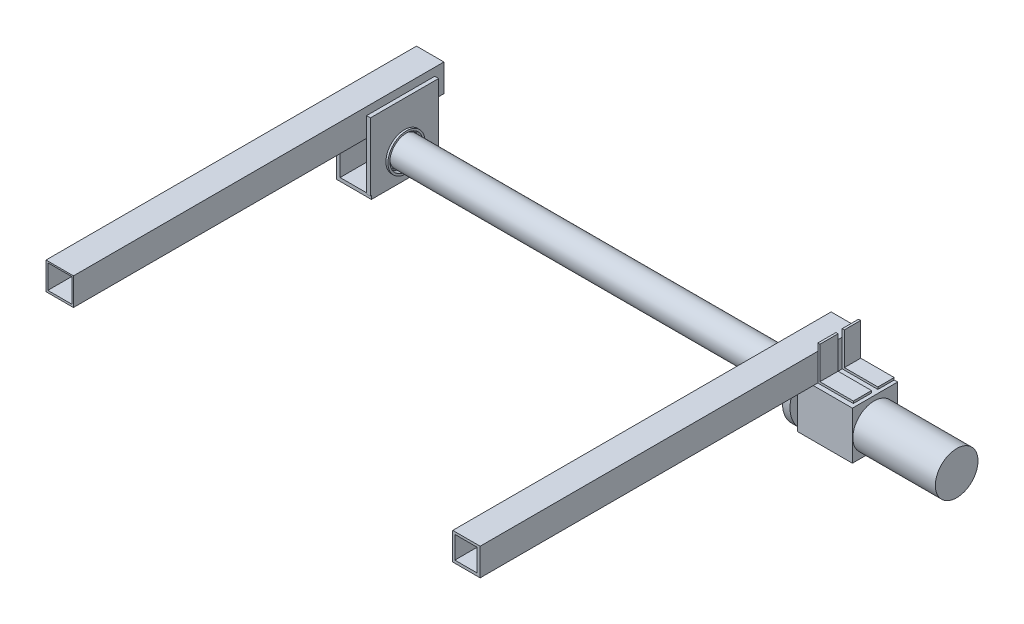
from build123d import *

# Parameters (mm, degrees)
SKETCH_1_W          = 25.57
SKETCH_1_H          = 25.57
EXTRUDE_1_DEPTH     = 345
SKETCH_2_W          = 22.27
SKETCH_2_H          = 22.27
CUT_EXTRUDE_1_DEPTH = 345
SKETCH_3_W          = 62.57
SKETCH_3_H          = 64.82
EXTRUDE_2_DEPTH     = 3.58
SKETCH_4_W          = 63.54
SKETCH_4_H          = 63.15
EXTRUDE_3_DEPTH     = 3.58
SKETCH_6_W          = 32.73
SKETCH_6_H          = 62.57
EXTRUDE_4_DEPTH     = 3.15
SKETCH_7_R          = 14.595
CUT_EXTRUDE_3_DEPTH = 3.32
SKETCH_8_R          = 17.266528804
EXTRUDE_5_DEPTH     = 1.86
SKETCH_9_R          = 15.5
CUT_EXTRUDE_5_DEPTH = 5
SKETCH_10_R         = 13.593774784
EXTRUDE_6_DEPTH     = 380
SKETCH_11_R         = 12.339130987
EXTRUDE_7_DEPTH     = 18
SKETCH_12_R         = 16.175538184
EXTRUDE_8_DEPTH     = 1.5
SKETCH_13_R         = 28
EXTRUDE_9_DEPTH     = 7
SKETCH_14_R         = 7.6
EXTRUDE_10_DEPTH    = 15.2
SKETCH_15_W         = 42.168470392
SKETCH_15_H         = 44.467815759
EXTRUDE_11_DEPTH    = 51.24
SKETCH_16_R         = 19.865
EXTRUDE_12_DEPTH    = 76.83
SKETCH_17_W         = 25.55
SKETCH_17_H         = 352.4
EXTRUDE_14_DEPTH    = 25.55
SKETCH_19_W         = 20.781659092
SKETCH_19_H         = 20.781659093
CUT_EXTRUDE_6_DEPTH = 358
SKETCH_20_W         = 16.912134217
SKETCH_20_H         = 32.244748354
EXTRUDE_15_DEPTH    = 2
SKETCH_21_W         = 15.223124647
SKETCH_21_H         = 32.461925803
EXTRUDE_16_DEPTH    = 2
SKETCH_22_W         = 31.1314176
SKETCH_22_H         = 16.912134217
EXTRUDE_17_DEPTH    = 2
SKETCH_23_W         = 31.20221205
SKETCH_23_H         = 15.223124647
EXTRUDE_18_DEPTH    = 2


with BuildPart() as part:
    # 草图1 → 凸台-拉伸1 (new body)
    with BuildSketch(Plane.XY):
        with Locations((-1.800204815, 0.409674702)):
            Rectangle(SKETCH_1_W, SKETCH_1_H)
    extrude(amount=EXTRUDE_1_DEPTH)

    # 草图2 → 切除-拉伸1 (cut)
    with BuildSketch(Plane.XY.offset(345)):
        with Locations((-1.734478046, 0.70158513)):
            Rectangle(SKETCH_2_W, SKETCH_2_H)
    extrude(amount=-CUT_EXTRUDE_1_DEPTH, mode=Mode.SUBTRACT)

    # 草图3 → 凸台-拉伸2 (add)
    with BuildSketch(Plane.ZY.offset(14.585204815)):
        with Locations((39.832355507, -24.812039034)):
            Rectangle(SKETCH_3_W, SKETCH_3_H)
    extrude(amount=EXTRUDE_2_DEPTH)

    # 草图4 → 凸台-拉伸3 (add)
    with BuildSketch(Plane(origin=(10.984795185, 0, 0), x_dir=(0, 0, -1), z_dir=(1, 0, 0))):
        with Locations((-40.317355507, -25.647039034)):
            Rectangle(SKETCH_4_W, SKETCH_4_H)
    extrude(amount=EXTRUDE_3_DEPTH)

    # 草图6 → 凸台-拉伸4 (add)
    with BuildSketch(Plane.XZ.offset(57.222039034)):
        with Locations((-1.800204815, 39.832355507)):
            Rectangle(SKETCH_6_W, SKETCH_6_H)
    extrude(amount=EXTRUDE_4_DEPTH)

    # 草图7 → 切除-拉伸3 (cut)
    with BuildSketch(Plane(origin=(14.564795185, 0, 0), x_dir=(0, 0, -1), z_dir=(1, 0, 0))):
        with Locations((-40.298008042, -36.351713038)):
            Circle(SKETCH_7_R)
    extrude(amount=-CUT_EXTRUDE_3_DEPTH, mode=Mode.SUBTRACT)

    # 草图8 → 凸台-拉伸5 (add)
    with BuildSketch(Plane(origin=(14.564795185, 0, 0), x_dir=(0, 0, -1), z_dir=(1, 0, 0))):
        with Locations((-40.298008042, -36.715804345)):
            Circle(SKETCH_8_R)
    extrude(amount=EXTRUDE_5_DEPTH)

    # 草图9 → 切除-拉伸5 (cut)
    with BuildSketch(Plane(origin=(16.424795185, 0, 0), x_dir=(0, 0, -1), z_dir=(1, 0, 0))):
        with Locations((-40.298008042, -36.715804345)):
            Circle(SKETCH_9_R)
    extrude(amount=-CUT_EXTRUDE_5_DEPTH, mode=Mode.SUBTRACT)

    # 草图11 → 凸台-拉伸7 (add)
    with BuildSketch(Plane.ZY.offset(-10.984795185)):
        with Locations(Location((37.360399055, -38.315560546, 0), (0, 0, 180))):
            Circle(SKETCH_11_R)
    extrude(amount=EXTRUDE_7_DEPTH)

    # 草图12 → 凸台-拉伸8 (add)
    with BuildSketch(Plane.ZY.offset(7.015204815)):
        with Locations((33.523991858, -38.315560546)):
            Circle(SKETCH_12_R)
    extrude(amount=EXTRUDE_8_DEPTH)


with BuildPart() as body_2:
    # 草图10 → 凸台-拉伸6 (new body)
    with BuildSketch(Plane(origin=(14.564795185, 0, 0), x_dir=(0, 0, -1), z_dir=(1, 0, 0))):
        with Locations((-40.298008042, -36.351713038)):
            Circle(SKETCH_10_R)
    extrude(amount=EXTRUDE_6_DEPTH)

    # 草图13 → 凸台-拉伸9 (add)
    with BuildSketch(Plane(origin=(394.564795185, 0, 0), x_dir=(0, 0, -1), z_dir=(1, 0, 0))):
        with Locations((-40.298008042, -36.351713038)):
            Circle(SKETCH_13_R)
    extrude(amount=EXTRUDE_9_DEPTH)

    # 草图14 → 凸台-拉伸10 (add)
    with BuildSketch(Plane(origin=(401.564795185, 0, 0), x_dir=(0, 0, -1), z_dir=(1, 0, 0))):
        with Locations(Location((-40.298008042, -36.351713038, 0), (0, 0, 180))):
            Circle(SKETCH_14_R)
    extrude(amount=EXTRUDE_10_DEPTH)

    # 草图15 → 凸台-拉伸11 (add)
    with BuildSketch(Plane(origin=(401.564795185, 0, 0), x_dir=(0, 0, -1), z_dir=(1, 0, 0))):
        with Locations((-40.34879958, -36.59076809)):
            Rectangle(SKETCH_15_W, SKETCH_15_H)
    extrude(amount=EXTRUDE_11_DEPTH)

    # 草图16 → 凸台-拉伸12 (add)
    with BuildSketch(Plane(origin=(452.804795185, 0, 0), x_dir=(0, 0, -1), z_dir=(1, 0, 0))):
        with Locations(Location((-41.144431097, -38.536072291, 0), (0, 0, 180))):
            Circle(SKETCH_16_R)
    extrude(amount=EXTRUDE_12_DEPTH)

    # 草图17 → 凸台-拉伸14 (add)
    with BuildSketch(Plane(origin=(0, -14.356860211, 0), x_dir=(1, 0, 0), z_dir=(0, 1, 0))):
        with Locations((403.622359348, -195.464564384)):
            Rectangle(SKETCH_17_W, SKETCH_17_H)
    extrude(amount=EXTRUDE_14_DEPTH)

    # 草图19 → 切除-拉伸6 (cut)
    with BuildSketch(Plane.XY.offset(371.664564384)):
        with Locations((403.20941807, -1.425128826)):
            Rectangle(SKETCH_19_W, SKETCH_19_H)
    extrude(amount=-CUT_EXTRUDE_6_DEPTH, mode=Mode.SUBTRACT)

    # 草图20 → 凸台-拉伸15 (add)
    with BuildSketch(Plane(origin=(416.397359348, 0, 0), x_dir=(0, 0, -1), z_dir=(1, 0, 0))):
        with Locations((-48.804866689, 1.765513966)):
            Rectangle(SKETCH_20_W, SKETCH_20_H)
    extrude(amount=EXTRUDE_15_DEPTH)

    # 草图21 → 凸台-拉伸16 (add)
    with BuildSketch(Plane(origin=(416.397359348, 0, 0), x_dir=(0, 0, -1), z_dir=(1, 0, 0))):
        with Locations((-26.876126707, 1.874102691)):
            Rectangle(SKETCH_21_W, SKETCH_21_H)
    extrude(amount=EXTRUDE_16_DEPTH)

    # 草图22 → 凸台-拉伸17 (add)
    with BuildSketch(Plane(origin=(0, -14.356860211, 0), x_dir=(1, 0, 0), z_dir=(0, 1, 0))):
        with Locations((433.963068148, -48.804866689)):
            Rectangle(SKETCH_22_W, SKETCH_22_H)
    extrude(amount=EXTRUDE_17_DEPTH)

    # 草图23 → 凸台-拉伸18 (add)
    with BuildSketch(Plane(origin=(0, -14.356860211, 0), x_dir=(1, 0, 0), z_dir=(0, 1, 0))):
        with Locations((433.998465373, -26.876126707)):
            Rectangle(SKETCH_23_W, SKETCH_23_H)
    extrude(amount=EXTRUDE_18_DEPTH)


solid = Compound([part.part, body_2.part])
